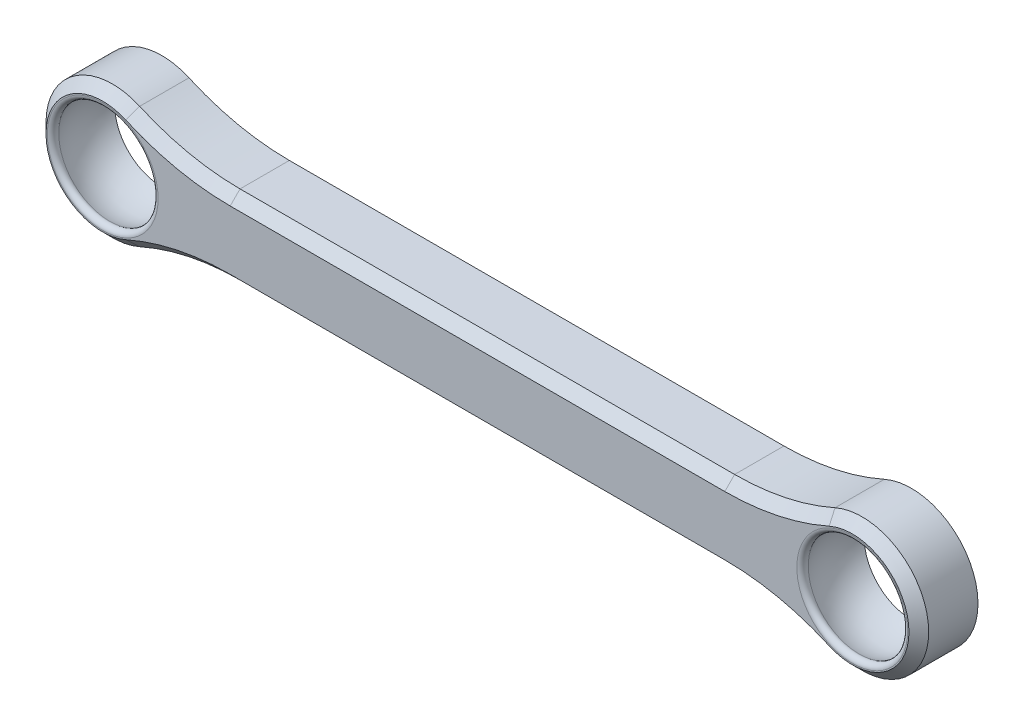
from build123d import *

# Parameters (mm, degrees)
BOSS_EXTRUDE2_DEPTH = 6
FILLET2_R           = 25
CHAMFER2_SIZE       = 1


with BuildPart() as part:
    # Sketch7 → Boss-Extrude2 (new body)
    with BuildSketch(Plane(origin=(0, 0, 0), x_dir=(-1, 0, 0), z_dir=(0, 0, -1))):
        with BuildLine():
            Line((-78.562859207, -4), (-13.437140793, -4))
            ThreePointArc((-13.437140793, -4), (-1.25, 0), (-13.437140793, 4))
            Line((-13.437140793, 4), (-78.562859207, 4))
            ThreePointArc((-78.562859207, 4), (-90.75, 0), (-78.562859207, -4))
        make_face()
    extrude(amount=-BOSS_EXTRUDE2_DEPTH)

    # Sketch10 → Cut-Revolve3 (revolve, cut)
    with BuildSketch(Plane(origin=(0, 0, 0), x_dir=(1, 0, 0), z_dir=(0, 1, 0))):
        with BuildLine():
            Line((88.787744772, 0), (84, 0))
            Line((84, 0), (84, -6))
            Line((84, -6), (89.618941181, -6))
            ThreePointArc((89.618941181, -6), (89.199640564, -5.772372891), (89.162116695, -5.296747967))
            ThreePointArc((89.162116695, -5.296747967), (89.635940078, -2.601654121), (88.787744772, 0))
        make_face()
    revolve(axis=Axis((84, 0, 0), (0, 0, 1)), mode=Mode.SUBTRACT)

    # Sketch13 → Cut-Revolve4 (revolve, cut)
    with BuildSketch(Plane(origin=(0, 0, 0), x_dir=(1, 0, 0), z_dir=(0, 1, 0))):
        with BuildLine():
            Line((12.787744772, 0), (8, 0))
            Line((8, 0), (8, -6))
            Line((8, -6), (13.618941181, -6))
            ThreePointArc((13.618941181, -6), (13.199640564, -5.772372891), (13.162116695, -5.296747967))
            ThreePointArc((13.162116695, -5.296747967), (13.635940078, -2.601654121), (12.787744772, 0))
        make_face()
    revolve(axis=Axis((8, 0, 0), (0, 0, 1)), mode=Mode.SUBTRACT)

    # Fillet2
    fillet2_edges = [part.edges().sort_by_distance(p)[0] for p in [
        (13.437140793, -4, 3),
        (78.562859207, -4, 3),
        (78.562859207, 4, 3),
        (13.437140793, 4, 3),
    ]]
    fillet(fillet2_edges, radius=FILLET2_R)

    # Chamfer2
    chamfer2_edges = [part.edges().sort_by_distance(p)[0] for p in [
        (46, 4, 6),
        (90.75, 0, 6),
        (46, -4, 6),
        (1.25, 0, 6),
        (76.277322741, 4.547329985, 6),
        (15.722677259, -4.547329985, 6),
        (76.277322741, -4.547329985, 6),
        (15.722677259, 4.547329985, 6),
    ]]
    chamfer(chamfer2_edges, length=CHAMFER2_SIZE)


solid = part.part
